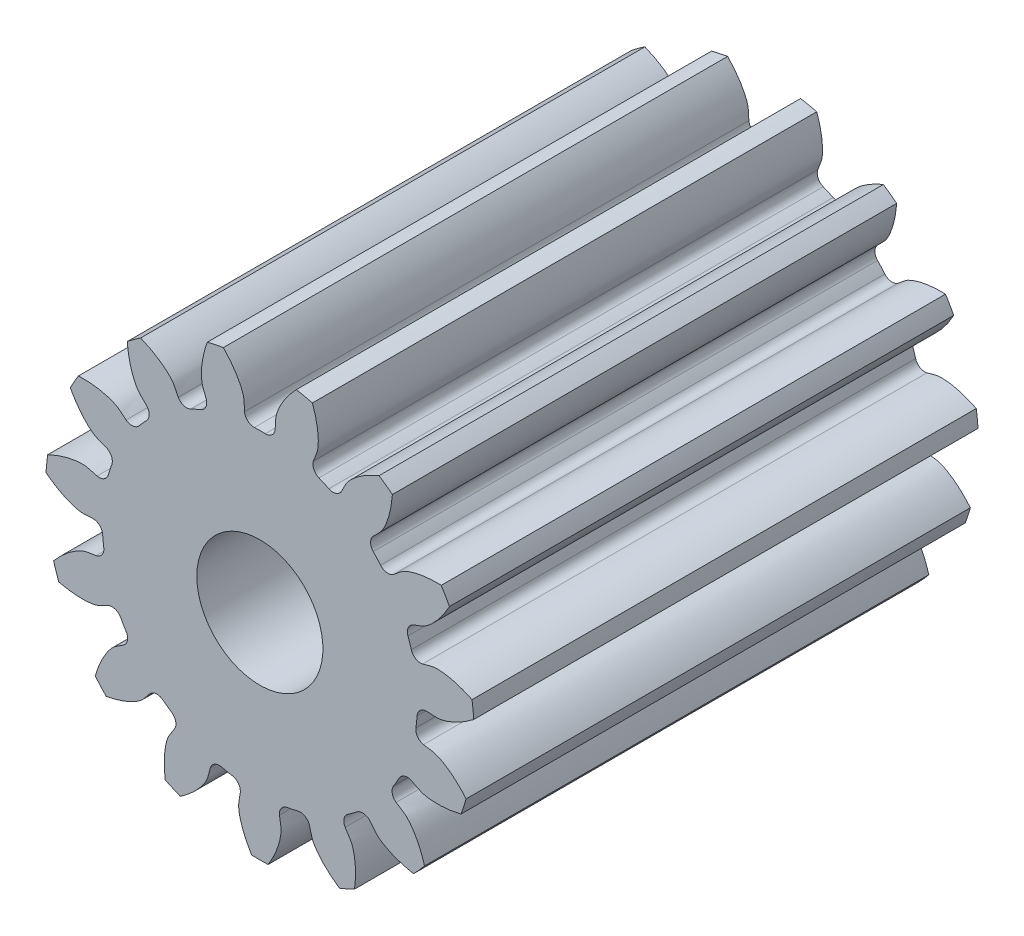
from build123d import *

# Parameters (mm, degrees)
SKETCH_1_R               = 8.5
LASHENA_DEPTH            = 20
CUT_EXTRUDEA_DEPTH       = 30
PATTERN_CIRCULAR_1_COUNT = 15
SKETCH_3_R               = 2.5
CUT_EXTRUDE_2_DEPTH      = 24.327727849


with BuildPart() as part:
    # 草图1 → LaShenA (new body)
    with BuildSketch(Plane.XY):
        Circle(SKETCH_1_R)
    extrude(amount=LASHENA_DEPTH)

    # SketchA → Cut-ExtrudeA (cut)
    with BuildSketch(Plane.XY.offset(20)):
        with BuildLine():
            ThreePointArc((0.215839917, 6.246271939), (0, 6.25), (-0.215839917, 6.246271939))
            ThreePointArc((-0.215839917, 6.246271939), (-0.479905557, 6.340689661), (-0.60729896, 6.590522184))
            add(Edge.make_bspline(
                [(-0.60729896, 6.590522184), (-0.62075147, 6.733797135), (-0.610957775, 6.90369499), (-0.644142955, 7.081493802), (-0.65705478, 7.130580145), (-0.66835729, 7.169380573), (-0.682757765, 7.213731897), (-0.700544374, 7.263496373), (-0.722065762, 7.318501199), (-0.747641624, 7.378565161), (-0.777590899, 7.443490359), (-0.812222054, 7.513065228), (-0.851835366, 7.587064006), (-0.896721486, 7.665247344), (-0.947161166, 7.747362591), (-1.003424643, 7.833144203), (-1.065771151, 7.922314137), (-1.134448411, 8.014582281), (-1.209692147, 8.109646893), (-1.291725619, 8.207195065), (-1.380759162, 8.306903196), (-1.476989783, 8.40843749), (-1.580600618, 8.511454476), (-1.731839286, 8.65315109), (-1.852380297, 8.756221537), (-1.93624085, 8.823885052)],
                knots=[0.123007883, 0.123007883, 0.123007883, 0.123007883, 0.262739282, 0.288008514, 0.299133382, 0.312280953, 0.327451227, 0.344644203, 0.363859883, 0.385098266, 0.408359351, 0.43364314, 0.460949632, 0.490278827, 0.521630724, 0.555005325, 0.590402629, 0.627822636, 0.667265346, 0.708730759, 0.752218875, 0.797729694, 0.845263216, 0.894819441, 1, 1, 1, 1], degree=3))
            ThreePointArc((-1.93624085, 8.823885052), (0, 9.033823999), (1.93624085, 8.823885052))
            add(Edge.make_bspline(
                [(0.60729896, 6.590522184), (0.62075147, 6.733797135), (0.610957775, 6.90369499), (0.644142955, 7.081493802), (0.65705478, 7.130580145), (0.66835729, 7.169380573), (0.682757765, 7.213731897), (0.700544374, 7.263496373), (0.722065762, 7.318501199), (0.747641624, 7.378565161), (0.777590899, 7.443490359), (0.812222054, 7.513065228), (0.851835366, 7.587064006), (0.896721486, 7.665247344), (0.947161166, 7.747362591), (1.003424643, 7.833144203), (1.065771151, 7.922314137), (1.134448411, 8.014582281), (1.209692147, 8.109646893), (1.291725619, 8.207195065), (1.380759162, 8.306903196), (1.476989783, 8.40843749), (1.580600618, 8.511454476), (1.731839286, 8.65315109), (1.852380297, 8.756221537), (1.93624085, 8.823885052)],
                knots=[0.123007883, 0.123007883, 0.123007883, 0.123007883, 0.262739282, 0.288008514, 0.299133382, 0.312280953, 0.327451227, 0.344644203, 0.363859883, 0.385098266, 0.408359351, 0.43364314, 0.460949632, 0.490278827, 0.521630724, 0.555005325, 0.590402629, 0.627822636, 0.667265346, 0.708730759, 0.752218875, 0.797729694, 0.845263216, 0.894819441, 1, 1, 1, 1], degree=3))
            ThreePointArc((0.60729896, 6.590522184), (0.479905557, 6.340689661), (0.215839917, 6.246271939))
        make_face()
    cut_extrudea = extrude(amount=-CUT_EXTRUDEA_DEPTH, mode=Mode.SUBTRACT)

    # 阵列(圆周)1: Cut-ExtrudeA ×15 about axis
    pattern_circular_1_axis = Axis((0, 0, -80.9), (0, 0, 1))
    for i in range(1, PATTERN_CIRCULAR_1_COUNT):
        add(cut_extrudea.rotate(pattern_circular_1_axis, i * 360 / PATTERN_CIRCULAR_1_COUNT), mode=Mode.SUBTRACT)

    # 草图3 → 切除-拉伸2 (cut, through all)
    with BuildSketch(Plane(origin=(0, 0, 0), x_dir=(-1, 0, 0), z_dir=(0, 0, -1))):
        Circle(SKETCH_3_R)
    extrude(amount=-CUT_EXTRUDE_2_DEPTH, mode=Mode.SUBTRACT)


solid = part.part
